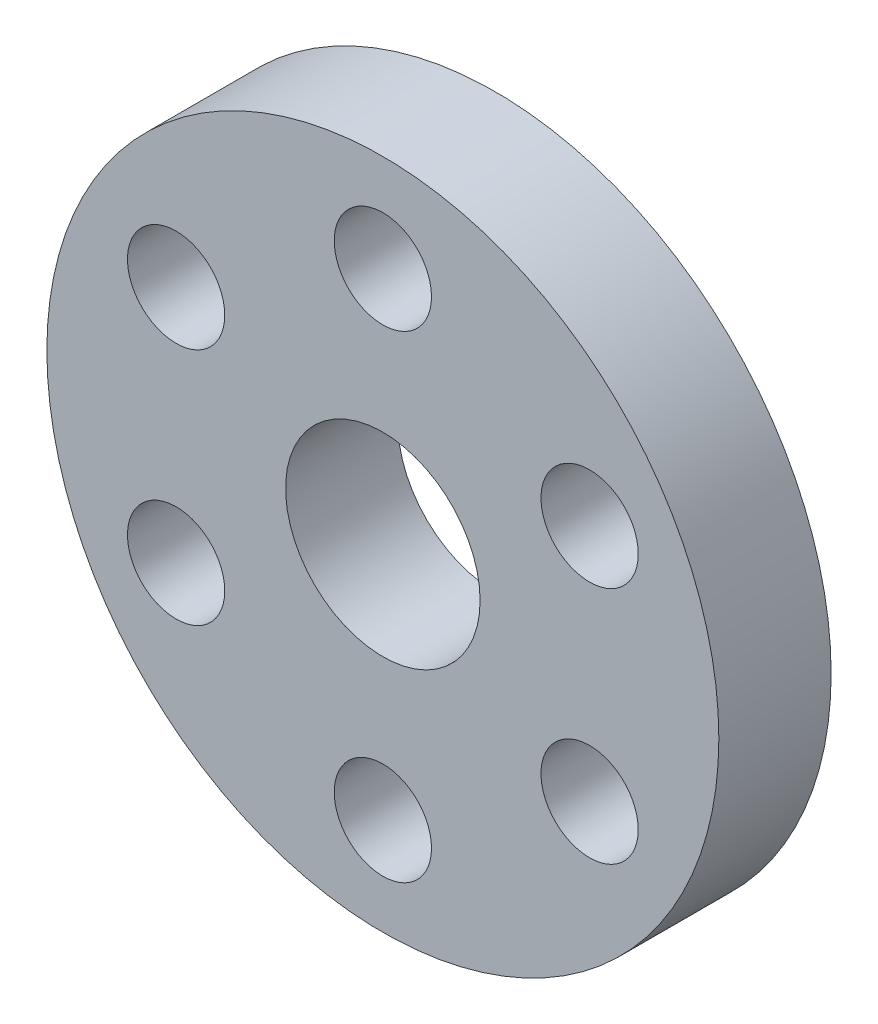
from build123d import *

# Parameters (mm, degrees)
SKETCH1_R         = 19
SKETCH1_R_2       = 5.5
EXTRUDE_1_4_DEPTH = 6.35
SKETCH2_R         = 2.75
M5_THROUGH_DEPTH  = 6.35


with BuildPart() as part:
    # Sketch1 → 1/4 (new body)
    with BuildSketch(Plane.XY):
        Circle(SKETCH1_R)
        Circle(SKETCH1_R_2, mode=Mode.SUBTRACT)
    extrude(amount=EXTRUDE_1_4_DEPTH)

    # Sketch2 → M5_through (cut)
    with BuildSketch(Plane.XY):
        with Locations((0, 13.5)):
            Circle(SKETCH2_R)
        with Locations((11.691342951, 6.75)):
            Circle(SKETCH2_R)
        with Locations((11.691342951, -6.75)):
            Circle(SKETCH2_R)
        with Locations((0, -13.5)):
            Circle(SKETCH2_R)
        with Locations((-11.691342951, -6.75)):
            Circle(SKETCH2_R)
        with Locations((-11.691342951, 6.75)):
            Circle(SKETCH2_R)
    extrude(amount=M5_THROUGH_DEPTH, mode=Mode.SUBTRACT)


solid = part.part
